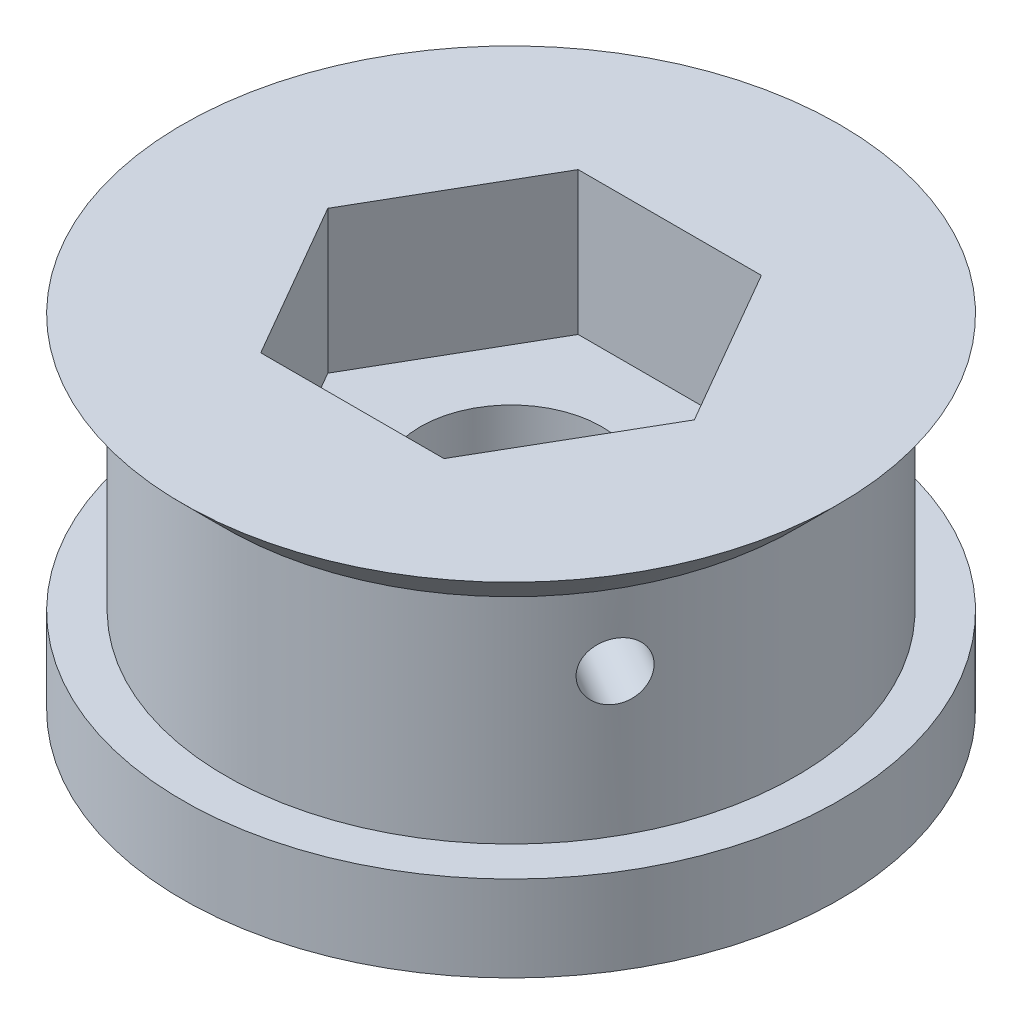
from build123d import *

# Parameters (mm, degrees)
CUT_EXTRUDE1_DEPTH = 5
SKETCH5_R          = 1
CUT_EXTRUDE3_DEPTH = 25.777841371


with BuildPart() as part:
    # Sketch1 → Revolve1 (revolve)
    with BuildSketch(Plane.XY, mode=Mode.PRIVATE) as revolve1_sk:
        Polygon((3.175, 0), (3.175, 12), (11.5, 12), (10, 10.5), (10, 3), (11.5, 3), (11.5, 0), align=None)
    revolve(revolve1_sk.sketch.rotate(Axis((0, 0, 0), (0, 1, 0)), 90), axis=Axis((0, 0, 0), (0, 1, 0)))

    # Sketch2 → Cut-Extrude1 (cut)
    with BuildSketch(Plane(origin=(0, 12, 0), x_dir=(1, 0, 0), z_dir=(0, 1, 0))):
        Polygon((3.207902433, 5.55625), (-3.207902433, 5.55625), (-6.415804866, 0), (-3.207902433, -5.55625), (3.207902433, -5.55625), (6.415804866, 0), align=None)
    extrude(amount=-CUT_EXTRUDE1_DEPTH, mode=Mode.SUBTRACT)

    # Sketch5 → Cut-Extrude3 (cut, through all)
    with BuildSketch(Plane(origin=(4.81185365, 0, 2.778125), x_dir=(-0.5000000000000006, 0, 0.8660254037844384), z_dir=(-0.8660254037844384, 0, -0.5000000000000006))):
        with Locations((0, 8)):
            Circle(SKETCH5_R)
    extrude(amount=-CUT_EXTRUDE3_DEPTH, mode=Mode.SUBTRACT)


solid = part.part
